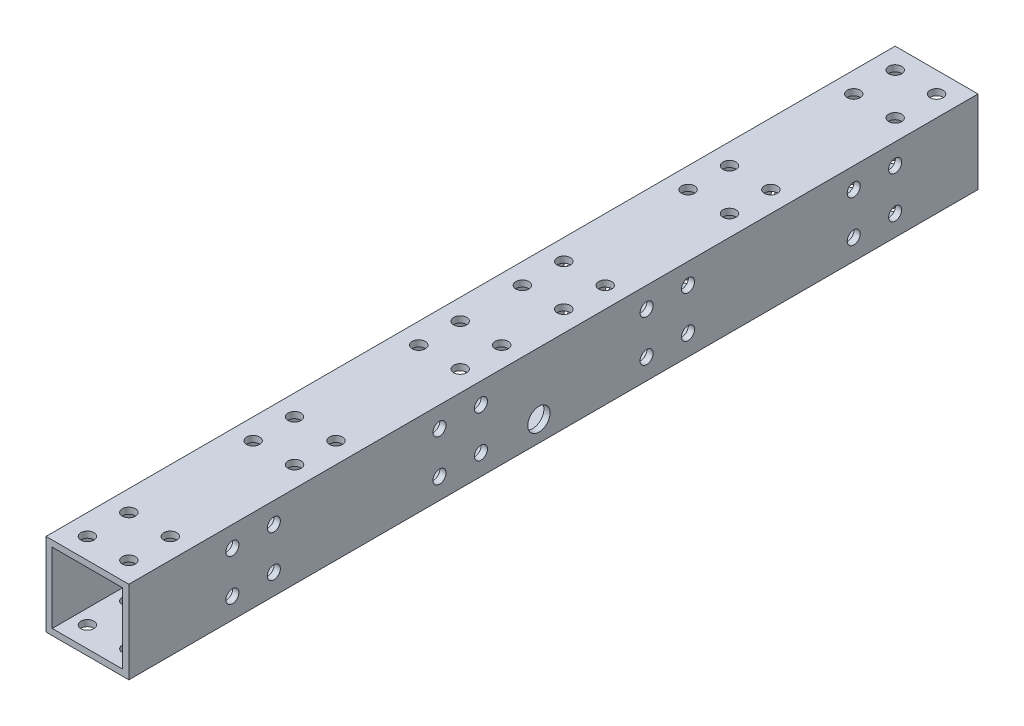
from build123d import *

# Parameters (mm, degrees)
SKETCH_1_W          = 20
SKETCH_1_H          = 20
SKETCH_1_W_2        = 17
SKETCH_1_H_2        = 17
EXTRUDE_1_DEPTH     = 205
SKETCH_2_R          = 2.7
SKETCH_2_R_2        = 1.575
CUT_EXTRUDE_1_DEPTH = 207.942020866
SKETCH_3_R          = 1.575
CUT_EXTRUDE_2_DEPTH = 207.942020866


with BuildPart() as part:
    # 草图1 → 拉伸-薄壁1 (new body)
    with BuildSketch(Plane.XY):
        with Locations((10, -10)):
            Rectangle(SKETCH_1_W, SKETCH_1_H)
        with Locations((10, -10)):
            Rectangle(SKETCH_1_W_2, SKETCH_1_H_2, mode=Mode.SUBTRACT)
    extrude(amount=EXTRUDE_1_DEPTH)

    # 草图2 → 切除-拉伸1 (cut, through all)
    with BuildSketch(Plane.ZY):
        with Locations(Location((106, -15, 0), (0, 0, 270))):
            Circle(SKETCH_2_R)
        with Locations(Location((180, -5, 0), (0, 0, 270))):
            Circle(SKETCH_2_R_2)
        with Locations(Location((180, -15, 0), (0, 0, 270))):
            Circle(SKETCH_2_R_2)
        with Locations(Location((170, -15, 0), (0, 0, 270))):
            Circle(SKETCH_2_R_2)
        with Locations(Location((170, -5, 0), (0, 0, 270))):
            Circle(SKETCH_2_R_2)
        with Locations(Location((120, -5, 0), (0, 0, 270))):
            Circle(SKETCH_2_R_2)
        with Locations(Location((130, -5, 0), (0, 0, 270))):
            Circle(SKETCH_2_R_2)
        with Locations(Location((120, -15, 0), (0, 0, 270))):
            Circle(SKETCH_2_R_2)
        with Locations(Location((130, -15, 0), (0, 0, 270))):
            Circle(SKETCH_2_R_2)
        with Locations(Location((70, -5, 0), (0, 0, 270))):
            Circle(SKETCH_2_R_2)
        with Locations(Location((80, -5, 0), (0, 0, 270))):
            Circle(SKETCH_2_R_2)
        with Locations(Location((70, -15, 0), (0, 0, 270))):
            Circle(SKETCH_2_R_2)
        with Locations(Location((80, -15, 0), (0, 0, 270))):
            Circle(SKETCH_2_R_2)
        with Locations(Location((20, -5, 0), (0, 0, 270))):
            Circle(SKETCH_2_R_2)
        with Locations(Location((30, -5, 0), (0, 0, 270))):
            Circle(SKETCH_2_R_2)
        with Locations(Location((20, -15, 0), (0, 0, 270))):
            Circle(SKETCH_2_R_2)
        with Locations(Location((30, -15, 0), (0, 0, 270))):
            Circle(SKETCH_2_R_2)
    extrude(amount=-CUT_EXTRUDE_1_DEPTH, mode=Mode.SUBTRACT)

    # 草图3 → 切除-拉伸2 (cut, through all)
    with BuildSketch(Plane(origin=(0, 0, 0), x_dir=(1, 0, 0), z_dir=(0, 1, 0))):
        with Locations(Location((5, -5, 0), (0, 0, 270))):
            Circle(SKETCH_3_R)
        with Locations(Location((15, -5, 0), (0, 0, 90))):
            Circle(SKETCH_3_R)
        with Locations(Location((15, -15, 0), (0, 0, 270))):
            Circle(SKETCH_3_R)
        with Locations(Location((5, -15, 0), (0, 0, 90))):
            Circle(SKETCH_3_R)
        with Locations(Location((5, -190, 0), (0, 0, 270))):
            Circle(SKETCH_3_R)
        with Locations(Location((15, -190, 0), (0, 0, 90))):
            Circle(SKETCH_3_R)
        with Locations(Location((15, -200, 0), (0, 0, 270))):
            Circle(SKETCH_3_R)
        with Locations(Location((5, -200, 0), (0, 0, 90))):
            Circle(SKETCH_3_R)
        with Locations(Location((5, -150, 0), (0, 0, 270))):
            Circle(SKETCH_3_R)
        with Locations(Location((15, -150, 0), (0, 0, 90))):
            Circle(SKETCH_3_R)
        with Locations(Location((5, -160, 0), (0, 0, 90))):
            Circle(SKETCH_3_R)
        with Locations(Location((15, -160, 0), (0, 0, 270))):
            Circle(SKETCH_3_R)
        with Locations(Location((5, -110, 0), (0, 0, 270))):
            Circle(SKETCH_3_R)
        with Locations(Location((15, -110, 0), (0, 0, 90))):
            Circle(SKETCH_3_R)
        with Locations(Location((5, -120, 0), (0, 0, 90))):
            Circle(SKETCH_3_R)
        with Locations(Location((15, -120, 0), (0, 0, 270))):
            Circle(SKETCH_3_R)
        with Locations(Location((15, -85, 0), (0, 0, 90))):
            Circle(SKETCH_3_R)
        with Locations(Location((5, -85, 0), (0, 0, 270))):
            Circle(SKETCH_3_R)
        with Locations(Location((15, -95, 0), (0, 0, 270))):
            Circle(SKETCH_3_R)
        with Locations(Location((5, -95, 0), (0, 0, 90))):
            Circle(SKETCH_3_R)
        with Locations(Location((15, -45, 0), (0, 0, 90))):
            Circle(SKETCH_3_R)
        with Locations(Location((5, -45, 0), (0, 0, 270))):
            Circle(SKETCH_3_R)
        with Locations(Location((15, -55, 0), (0, 0, 270))):
            Circle(SKETCH_3_R)
        with Locations(Location((5, -55, 0), (0, 0, 90))):
            Circle(SKETCH_3_R)
    extrude(amount=-CUT_EXTRUDE_2_DEPTH, mode=Mode.SUBTRACT)


solid = part.part
